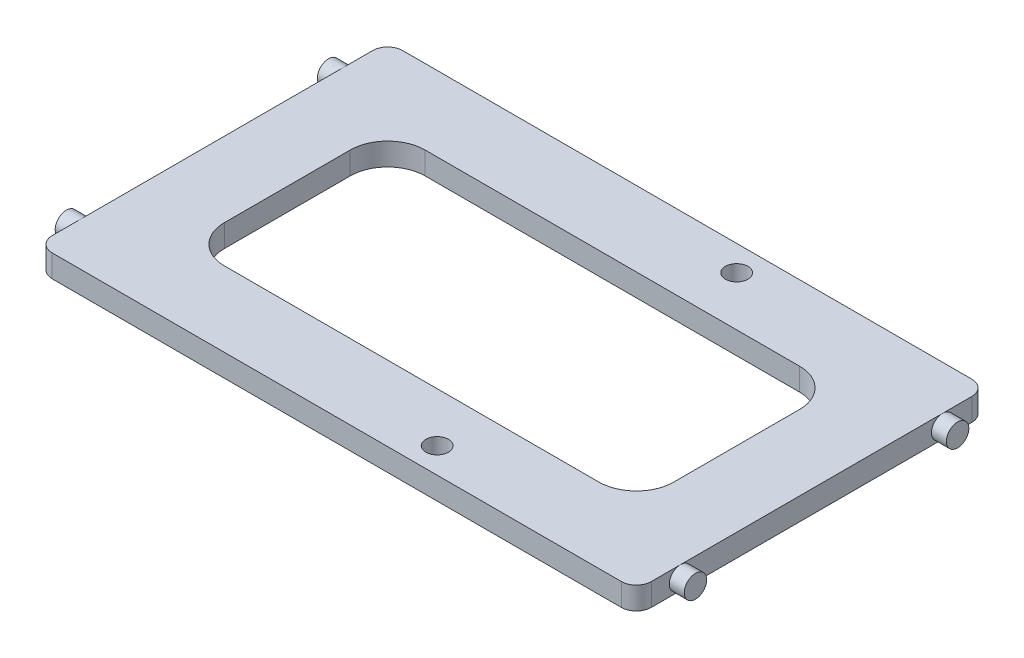
from build123d import *

# Parameters (mm, degrees)
SKETCH1_W                       = 101.6
SKETCH1_H                       = 59.436
BASE_EXTRUDE_DEPTH              = 3.81
BASE_CORNER_FILLET_R            = 2.54
SKETCH3_R                       = 1.905
PEG_EXTRUDE_DEPTH               = 2.54
MATERIAL_REMOVAL_CUT_DEPTH      = 120.96788652
SKETCH5_R                       = 1.905
REMOTE_CONTROL_HOLDER_CUT_DEPTH = 120.96788652


with BuildPart() as part:
    # Sketch1 → Base Extrude (new body)
    with BuildSketch(Plane(origin=(0, 0, 0), x_dir=(1, 0, 0), z_dir=(0, 1, 0))):
        with Locations((50.8, 29.718)):
            Rectangle(SKETCH1_W, SKETCH1_H)
    extrude(amount=BASE_EXTRUDE_DEPTH)

    # Base Corner Fillet
    base_corner_fillet_edges = [part.edges().sort_by_distance(p)[0] for p in [
        (0, 1.905, -59.436),
        (101.6, 1.905, -59.436),
        (101.6, 1.905, 0),
        (0, 1.905, 0),
    ]]
    fillet(base_corner_fillet_edges, radius=BASE_CORNER_FILLET_R)

    # Sketch3 → Peg Extrude (add)
    with BuildSketch(Plane.ZY):
        with Locations(Location((-7.493, 1.905, 0), (0, 0, 270))):
            Circle(SKETCH3_R)
        with Locations(Location((-51.943, 1.905, 0), (0, 0, 180))):
            Circle(SKETCH3_R)
    peg_extrude = extrude(amount=PEG_EXTRUDE_DEPTH)

    # Peg Mirror: Peg Extrude across plane
    add(peg_extrude.mirror(Plane(origin=(50.8, 0, 0), x_dir=(0, 0, 1), z_dir=(1, 0, 0))))

    # Sketch4 → Material Removal Cut (cut, through all)
    with BuildSketch(Plane.XZ):
        with BuildLine():
            Line((19.05, -12.7), (82.55, -12.7))
            ThreePointArc((82.55, -12.7), (87.040128061, -14.559871939), (88.9, -19.05))
            Line((88.9, -19.05), (88.9, -40.386))
            ThreePointArc((88.9, -40.386), (87.040128061, -44.876128061), (82.55, -46.736))
            Line((82.55, -46.736), (19.05, -46.736))
            ThreePointArc((19.05, -46.736), (14.559871939, -44.876128061), (12.7, -40.386))
            Line((12.7, -40.386), (12.7, -19.05))
            ThreePointArc((12.7, -19.05), (14.559871939, -14.559871939), (19.05, -12.7))
        make_face()
    extrude(amount=-MATERIAL_REMOVAL_CUT_DEPTH, mode=Mode.SUBTRACT)

    # Sketch5 → Remote Control Holder Cut (cut, through all)
    with BuildSketch(Plane(origin=(0, 3.81, 0), x_dir=(1, 0, 0), z_dir=(0, 1, 0))):
        with Locations(Location((63.5, 4.318, 0), (0, 0, 270))):
            Circle(SKETCH5_R)
        with Locations(Location((63.5, 55.118, 0), (0, 0, 270))):
            Circle(SKETCH5_R)
    extrude(amount=-REMOTE_CONTROL_HOLDER_CUT_DEPTH, mode=Mode.SUBTRACT)


solid = part.part
